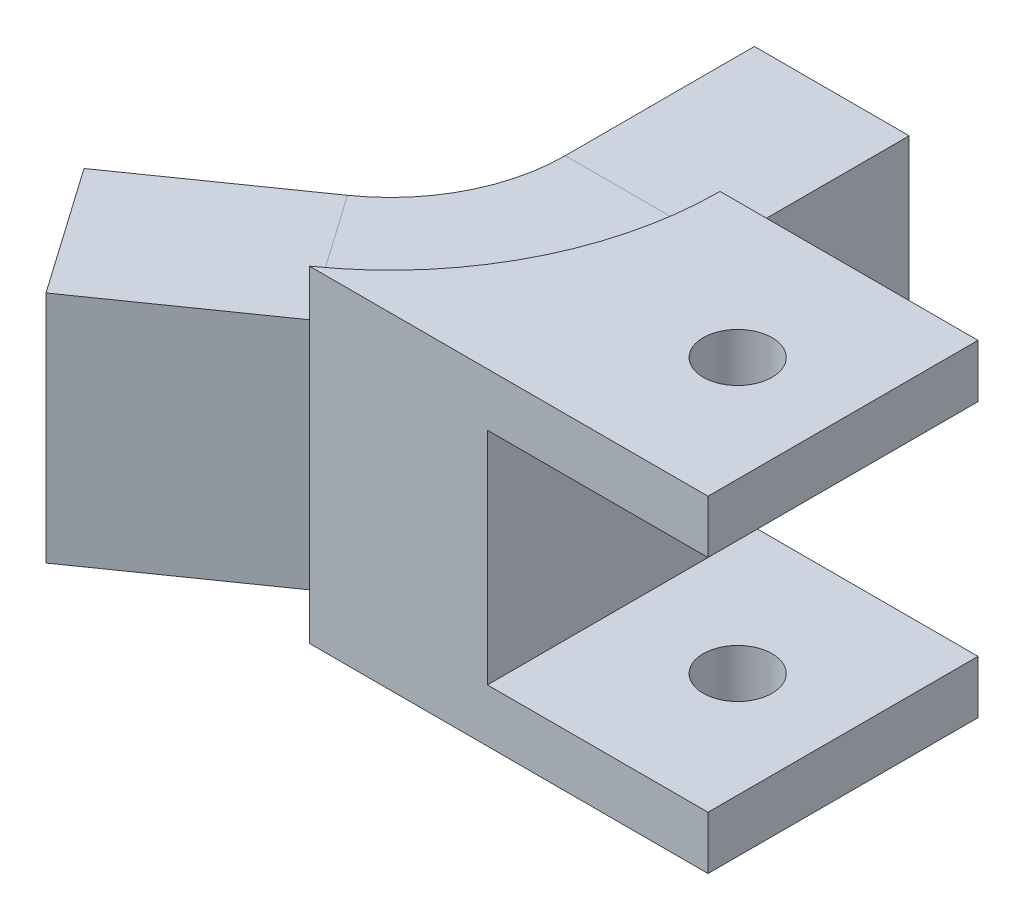
from build123d import *

# Parameters (mm, degrees)
BOSS_EXTRUDE1_DEPTH      = 15
BOSS_EXTRUDE2_DEPTH      = 15
BOSS_EXTRUDE3_DEPTH      = 19
BOSS_EXTRUDE3_DEPTH_BACK = 19
BOSS_EXTRUDE3_START      = -13.6
SKETCH9_W                = 25.65
SKETCH9_H                = 25.65
CUT_EXTRUDE2_DEPTH       = 41
SKETCH10_R               = 4
CUT_EXTRUDE3_DEPTH       = 41


with BuildPart() as part:
    # Sweep1: sweep along a path in Sketch1
    with BuildLine(Plane(origin=(0, 0, 0), x_dir=(1, 0, 0), z_dir=(0, 1, 0))) as sweep1_path:
        Line((21.279643058, 26.852704607), (21.279643058, 4.852704607))
        ThreePointArc((21.279643058, 4.852704607), (17.372739998, -11.11349039), (6.534906261, -23.471671247))
        Line((6.534906261, -23.471671247), (-11.486438713, -36.090352847))
    # Sketch5 → Sweep1 (sweep)
    with BuildSketch(Plane.XY.offset(-26.852704607)):
        Polygon((21.279643058, 9.6), (21.279643058, 0), (21.279643058, -9.6), (7.029643058, -9.6), (7.029643058, -13.6), (25.029643058, -13.6), (25.029643058, 13.6), (7.029643058, 13.6), (7.029643058, 9.6), align=None)
    sweep(path=sweep1_path.line)

    # Sketch6 → Boss-Extrude1 (add)
    with BuildSketch(Plane(origin=(0, 0, -26.852704607), x_dir=(-1, 0, 0), z_dir=(0, 0, -1))):
        Polygon((-7.029643058, 9.6), (-10.029643058, 8.1), (-10.029643058, 9.6), align=None)
        Polygon((-7.029643058, -9.6), (-10.029643058, -8.1), (-10.029643058, -9.6), align=None)
    extrude(amount=-BOSS_EXTRUDE1_DEPTH)

    # Sketch7 → Boss-Extrude2 (add)
    with BuildSketch(Plane(origin=(-24.66443519, 0, 17.270223446), x_dir=(0.5735764363510444, 0, 0.8191520442889931), z_dir=(-0.8191520442889931, 0, 0.5735764363510444))):
        Polygon((8.72513573, 9.6), (11.72513573, 8.1), (11.72513573, 9.6), align=None)
        Polygon((11.72513573, -8.1), (11.72513573, -9.6), (8.72513573, -9.6), align=None)
    extrude(amount=-BOSS_EXTRUDE2_DEPTH)

    # Sketch8 → Boss-Extrude3 (add, two sides: drawn at the far end of the back side and taken through both)
    with BuildSketch(Plane(origin=(0, 13.6, 0), x_dir=(1, 0, 0), z_dir=(0, 1, 0)).offset(BOSS_EXTRUDE3_START - BOSS_EXTRUDE3_DEPTH_BACK)):
        with BuildLine():
            Line((8.685817898, -26.543491413), (25.029643058, -26.543491413))
            Line((25.029643058, -26.543491413), (55.029643058, -26.543491413))
            Line((55.029643058, -26.543491413), (55.029643058, 4.852704607))
            Line((55.029643058, 4.852704607), (25.029643058, 4.852704607))
            ThreePointArc((25.029643058, 4.852704607), (20.699030623, -12.84504769), (8.685817898, -26.543491413))
        make_face()
    extrude(amount=BOSS_EXTRUDE3_DEPTH + BOSS_EXTRUDE3_DEPTH_BACK)

    # Sketch9 → Cut-Extrude2 (cut)
    with BuildSketch(Plane(origin=(0, 0, -4.852704607), x_dir=(-1, 0, 0), z_dir=(0, 0, -1))):
        with Locations((-42.204643058, 0)):
            Rectangle(SKETCH9_W, SKETCH9_H)
    extrude(amount=-CUT_EXTRUDE2_DEPTH, mode=Mode.SUBTRACT)

    # Sketch10 → Cut-Extrude3 (cut)
    with BuildSketch(Plane.XZ.offset(19)):
        with Locations(Location((42.779643058, 10.845393403, 0), (0, 0, 270))):
            Circle(SKETCH10_R)
    extrude(amount=-CUT_EXTRUDE3_DEPTH, mode=Mode.SUBTRACT)


solid = part.part
